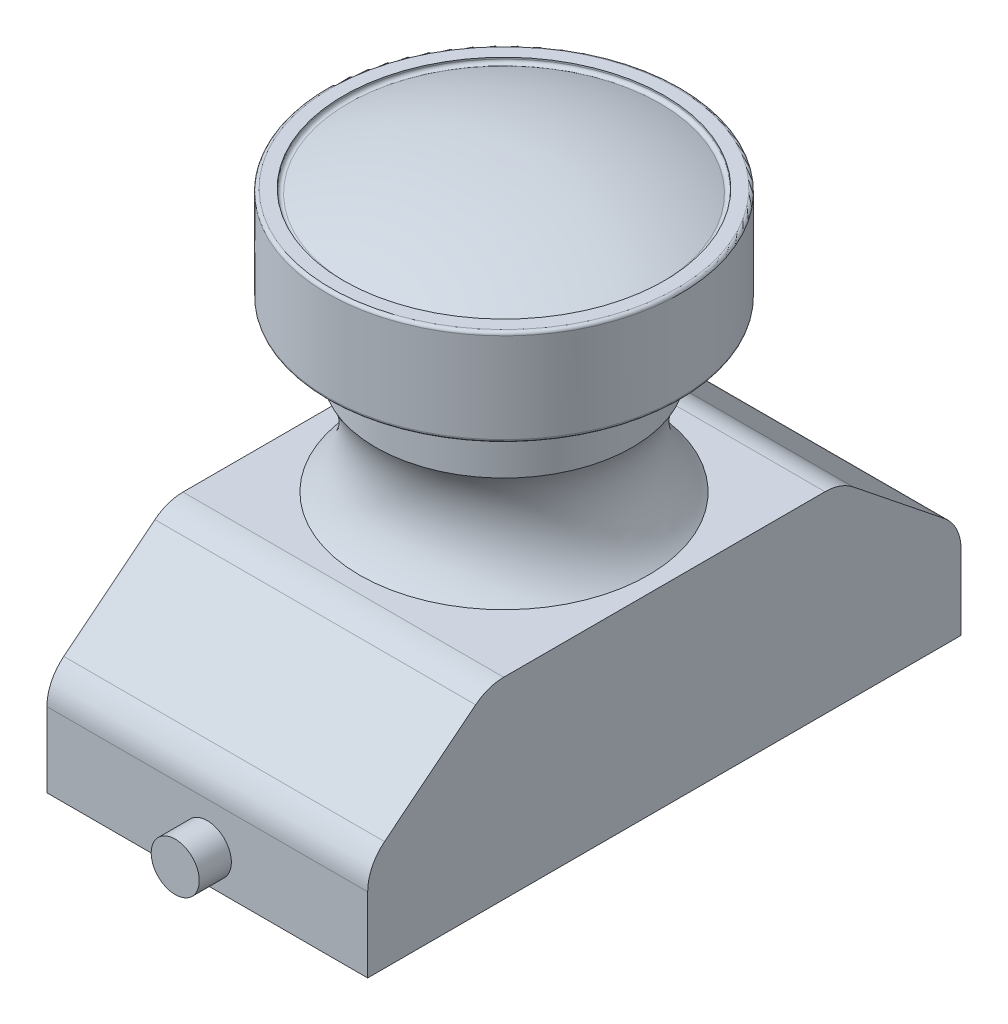
from build123d import *

# Parameters (mm, degrees)
BOSS_EXTRUDE1_DEPTH = 5
FILLET1_R           = 0.1
FILLET2_R           = 1.4
SKETCH4_R           = 0.75
BOSS_EXTRUDE2_DEPTH = 1


with BuildPart() as part:
    # Sketch1 → Boss-Extrude1 (new, symmetric)
    with BuildSketch(Plane(origin=(0, 0, 0), x_dir=(0, 0, -1), z_dir=(1, 0, 0))):
        Polygon((-9.25, 0), (9.25, 0), (9.25, 3), (5.5, 6), (-5.5, 6), (-9.25, 3), align=None)
    extrude(amount=BOSS_EXTRUDE1_DEPTH, both=True)

    # Sketch2 → Revolve1 (revolve)
    with BuildSketch(Plane(origin=(0, 0, 0), x_dir=(0, 0, -1), z_dir=(1, 0, 0)), mode=Mode.PRIVATE) as revolve1_sk:
        with BuildLine():
            Line((0, 14), (0, 6))
            Line((0, 6), (4.5, 6))
            ThreePointArc((4.5, 6), (3.661737334, 7.508083958), (4, 9.2))
            Line((4, 9.2), (4, 11.2))
            Line((4, 11.2), (5.5, 11.2))
            Line((5.5, 11.2), (5.5, 14.2))
            Line((5.5, 14.2), (5, 14.2))
            Line((5, 14.2), (5, 14))
            Line((5, 14), (0, 14))
        make_face()
    revolve(revolve1_sk.sketch.rotate(Axis((0, 14, 0), (0, -1, 0)), 180), axis=Axis((0, 14, 0), (0, -1, 0)))

    # Sketch3 → Revolve2 (revolve)
    with BuildSketch(Plane(origin=(0, 0, 0), x_dir=(0, 0, -1), z_dir=(1, 0, 0))):
        with BuildLine():
            Line((0, 15), (0, 14.2))
            Line((0, 14.2), (0, 14))
            Line((0, 14), (-5, 14))
            ThreePointArc((-5, 14), (-2.553728094, 14.768640471), (0, 15))
        make_face()
    revolve(axis=Axis((0, 15, 0), (0, -1, 0)))

    # Fillet1
    fillet1_edges = [part.edges().sort_by_distance(p)[0] for p in [
        (0, 14, -5),
        (0, 11.2, -5.5),
        (0, 14.2, -5.5),
    ]]
    fillet(fillet1_edges, radius=FILLET1_R)

    # Fillet2
    fillet2_edges = [part.edges().sort_by_distance(p)[0] for p in [
        (0, 3, 9.25),
        (0, 6, 5.5),
        (0, 6, -5.5),
        (0, 3, -9.25),
    ]]
    fillet(fillet2_edges, radius=FILLET2_R)

    # Sketch4 → Boss-Extrude2 (add, symmetric)
    with BuildSketch(Plane(origin=(0, 0, -9.25), x_dir=(-1, 0, 0), z_dir=(0, 0, -1))):
        with Locations(Location((0, 1, 0), (0, 0, 180))):
            Circle(SKETCH4_R)
    boss_extrude2 = extrude(amount=BOSS_EXTRUDE2_DEPTH, both=True)

    # Mirror1: Boss-Extrude2 across plane
    add(boss_extrude2.mirror(Plane.XY))


solid = part.part
